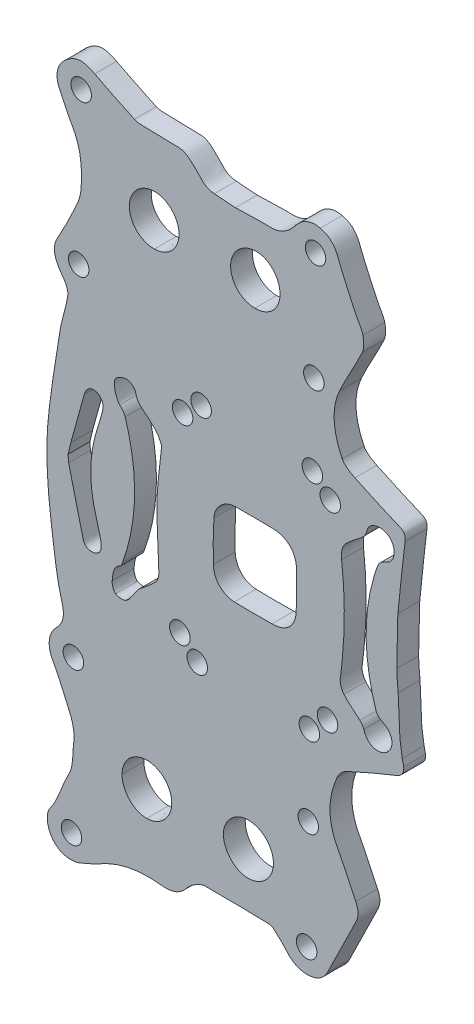
from build123d import *

# Parameters (mm, degrees)
BOSS_EXTRUDE4_DEPTH = 4
SKETCH1_R           = 1.875
CUT_EXTRUDE1_DEPTH  = 232.41140574


with BuildPart() as part:
    # Model → Boss-Extrude4 (new body)
    with BuildSketch(Plane.XY):
        with BuildLine():
            add(Edge.make_bspline(
                [(131.262063805, -129.37444485), (131.270879822, -130.612852398), (131.429599139, -131.850185075), (131.521852093, -133.088396252)],
                knots=[63, 63, 63, 63, 64, 64, 64, 64], degree=3))
            add(Edge.make_bspline(
                [(131.521852093, -133.088396252), (131.620643676, -135.363303843), (131.686639014, -137.640305557), (131.832494038, -139.91218618), (131.901837551, -140.992315682), (132.128453732, -142.061992272), (132.273283308, -143.13781669)],
                knots=[0, 0, 0, 0, 1, 1, 1, 2, 2, 2, 2], degree=3))
            add(Edge.make_bspline(
                [(132.273283308, -143.13781669), (132.375975693, -143.518434283), (132.454352202, -143.905959149), (132.534205797, -144.292313982)],
                knots=[2, 2, 2, 2, 3, 3, 3, 3], degree=3))
            add(Edge.make_bspline(
                [(132.534205797, -144.292313982), (132.629848732, -145.370658624), (132.155602813, -145.963006101), (131.121462282, -146.377038519), (128.065373871, -147.600594231), (125.025387869, -148.875588768), (122.04851959, -150.27781094)],
                knots=[3, 3, 3, 3, 4, 4, 4, 5, 5, 5, 5], degree=3))
            add(Edge.make_bspline(
                [(122.04851959, -150.27781094), (121.317058873, -150.62234875), (120.620810549, -151.43223378), (120.300757083, -152.193212135)],
                knots=[5, 5, 5, 5, 6, 6, 6, 6], degree=3))
            add(Edge.make_bspline(
                [(120.300757083, -152.193212135), (118.764031219, -155.846950036), (118.443450651, -159.512780247), (120.424201995, -163.182971958), (121.628585712, -165.414602556), (122.621674402, -167.759311752), (123.758547889, -170.028748905)],
                knots=[6, 6, 6, 6, 7, 7, 7, 8, 8, 8, 8], degree=3))
            add(Edge.make_bspline(
                [(123.758547889, -170.028748905), (124.339753906, -171.188949182), (124.311042422, -172.250271572), (123.724772105, -173.411246997), (121.971996973, -176.882215321), (120.272376328, -180.380241479), (118.573324125, -183.878060932)],
                knots=[8, 8, 8, 8, 9, 9, 9, 10, 10, 10, 10], degree=3))
            add(Edge.make_bspline(
                [(118.573324125, -183.878060932), (117.272853055, -186.555339653), (113.293532298, -186.793444467), (111.280338424, -184.355655491)],
                knots=[10, 10, 10, 10, 11, 11, 11, 11], degree=3))
            add(Edge.make_bspline(
                [(111.280338424, -184.355655491), (110.500456791, -183.411297776), (109.564853082, -182.586705603), (108.63927462, -181.77720298)],
                knots=[11, 11, 11, 11, 12, 12, 12, 12], degree=3))
            add(Edge.make_bspline(
                [(108.63927462, -181.77720298), (108.380292485, -181.550673711), (107.905777848, -181.498294372), (107.527805318, -181.491287034), (103.776626138, -181.421730414), (100.02469248, -181.337952412), (96.273730341, -181.36478287)],
                knots=[12, 12, 12, 12, 13, 13, 13, 14, 14, 14, 14], degree=3))
            add(Edge.make_bspline(
                [(96.273730341, -181.36478287), (95.588375431, -181.369702477), (94.855850178, -181.771601243), (94.237840132, -182.144106396)],
                knots=[14, 14, 14, 14, 15, 15, 15, 15], degree=3))
            add(Edge.make_bspline(
                [(94.237840132, -182.144106396), (93.669615262, -182.486597815), (93.165458963, -182.986392614), (92.739623624, -183.504480908)],
                knots=[15, 15, 15, 15, 16, 16, 16, 16], degree=3))
            add(Edge.make_bspline(
                [(92.739623624, -183.504480908), (91.512078483, -184.997932839), (89.969988595, -185.440676741), (88.089603422, -185.223097848)],
                knots=[16, 16, 16, 16, 17, 17, 17, 17], degree=3))
            add(Edge.make_bspline(
                [(88.089603422, -185.223097848), (84.089953115, -184.76032412), (80.316020755, -185.457316586), (76.815359093, -187.545090039), (75.804870912, -188.147741818), (74.657600105, -188.517229061), (73.589120515, -189.027317826)],
                knots=[17, 17, 17, 17, 18, 18, 18, 19, 19, 19, 19], degree=3))
            add(Edge.make_bspline(
                [(73.589120515, -189.027317826), (71.93733684, -189.815901787), (69.856136643, -189.49935199), (68.654336754, -188.245741204)],
                knots=[19, 19, 19, 19, 20, 20, 20, 20], degree=3))
            add(Edge.make_bspline(
                [(68.654336754, -188.245741204), (67.359663791, -186.895247246), (66.84987475, -184.513516977), (67.912313353, -183.089890383)],
                knots=[20, 20, 20, 20, 21, 21, 21, 21], degree=3))
            add(Edge.make_bspline(
                [(67.912313353, -183.089890383), (69.472024941, -180.999987857), (69.959029797, -178.454711683), (71.190001092, -176.268504762)],
                knots=[21, 21, 21, 21, 22, 22, 22, 22], degree=3))
            add(Edge.make_bspline(
                [(71.190001092, -176.268504762), (72.226038152, -174.428551312), (71.912408079, -172.533427991), (72.178464732, -170.647709799), (72.591122553, -167.722900464), (70.9986067, -165.452264416), (70.018736868, -162.980017525)],
                knots=[22, 22, 22, 22, 23, 23, 23, 24, 24, 24, 24], degree=3))
            add(Edge.make_bspline(
                [(70.018736868, -162.980017525), (69.513929445, -161.706356243), (68.837607594, -160.498685899), (68.208760977, -159.276649477), (67.341711362, -157.591715304), (67.555254318, -155.515279684), (68.882467996, -154.163669512)],
                knots=[24, 24, 24, 24, 25, 25, 25, 26, 26, 26, 26], degree=3))
            add(Edge.make_bspline(
                [(68.882467996, -154.163669512), (70.17542013, -152.846961674), (70.617135668, -151.534284606), (70.057861175, -149.60941627), (69.291301754, -146.971142999), (68.902110248, -144.20822592), (68.528618073, -141.474485415), (68.039830377, -137.896877388), (67.576570889, -134.303683718), (67.379228528, -130.702025431), (67.210514969, -127.62289962), (67.204949406, -124.497988396), (67.533100586, -121.43684602), (68.066598823, -116.460157755), (68.874592491, -111.50967983), (69.683526673, -106.567263444)],
                knots=[26, 26, 26, 26, 27, 27, 27, 28, 28, 28, 29, 29, 29, 30, 30, 30, 31, 31, 31, 31], degree=3))
            add(Edge.make_bspline(
                [(69.683526673, -106.567263444), (70.023780498, -104.488430032), (70.789435579, -102.477241208), (71.097975514, -100.396206376), (71.213074666, -99.619869754), (70.7621452, -98.589801334), (70.249069531, -97.921158616)],
                knots=[31, 31, 31, 31, 32, 32, 32, 33, 33, 33, 33], degree=3))
            add(Edge.make_bspline(
                [(70.249069531, -97.921158616), (68.529894484, -95.680701666), (68.180018487, -93.996056882), (69.252528848, -92.12058098)],
                knots=[33, 33, 33, 33, 34, 34, 34, 34], degree=3))
            add(Edge.make_bspline(
                [(69.252528848, -92.12058098), (69.824133364, -91.121012052), (70.365734482, -90.10215744), (70.873663168, -89.068812727)],
                knots=[34, 34, 34, 34, 35, 35, 35, 35], degree=3))
            add(Edge.make_bspline(
                [(70.873663168, -89.068812727), (71.606457139, -87.577965294), (72.343974346, -86.085908629), (72.983404317, -84.554257401), (73.279908785, -83.844030574), (73.44502049, -83.046749452), (73.505978134, -82.275978393), (73.767166857, -78.973429072), (73.551112421, -75.762926), (71.770860875, -72.805116028)],
                knots=[35, 35, 35, 35, 36, 36, 36, 37, 37, 37, 38, 38, 38, 38], degree=3))
            add(Edge.make_bspline(
                [(71.770860875, -72.805116028), (70.951865272, -71.444400451), (70.379914523, -69.937331752), (69.644758934, -68.523234311), (68.661023698, -66.630984205), (69.088140615, -64.542668149), (70.791383785, -63.184686261)],
                knots=[38, 38, 38, 38, 39, 39, 39, 40, 40, 40, 40], degree=3))
            add(Edge.make_bspline(
                [(70.791383785, -63.184686261), (72.623942322, -61.723620015), (73.884953188, -61.695099734), (76.012967161, -62.811907223)],
                knots=[40, 40, 40, 40, 41, 41, 41, 41], degree=3))
            add(Edge.make_bspline(
                [(76.012967161, -62.811907223), (78.399575694, -64.064412131), (80.842956072, -65.210385857), (83.281142957, -66.361377374)],
                knots=[41, 41, 41, 41, 42, 42, 42, 42], degree=3))
            add(Edge.make_bspline(
                [(83.281142957, -66.361377374), (83.696090049, -66.557267625), (84.20728986, -66.605895247), (84.677003747, -66.619512014), (86.960946504, -66.685719994), (89.247964014, -66.675756758), (91.529049058, -66.789698355), (92.091155426, -66.817774218), (92.724802793, -67.097948901), (93.168425196, -67.456599573), (94.042523491, -68.163276222), (94.838962286, -68.975972456), (95.606141825, -69.801825535), (96.247137595, -70.491841669), (96.999506638, -70.786062035), (97.918563521, -70.836214114)],
                knots=[42, 42, 42, 42, 43, 43, 43, 44, 44, 44, 45, 45, 45, 46, 46, 46, 47, 47, 47, 47], degree=3))
            add(Edge.make_bspline(
                [(97.918563521, -70.836214114), (99.199087447, -70.906101463), (100.475446245, -71.120967338), (101.754657588, -71.13061018)],
                knots=[47, 47, 47, 47, 48, 48, 48, 48], degree=3))
            add(Edge.make_bspline(
                [(101.754657588, -71.13061018), (103.821698414, -71.146211327), (105.895012771, -70.929226714), (107.955687048, -71.025143535), (110.148229512, -71.127199529), (111.549356142, -69.994899414), (112.778430908, -68.440479504)],
                knots=[48, 48, 48, 48, 49, 49, 49, 50, 50, 50, 50], degree=3))
            add(Edge.make_bspline(
                [(112.778430908, -68.440479504), (113.936305741, -66.976121464), (115.375414625, -66.189475373), (117.274310334, -66.609218048)],
                knots=[50, 50, 50, 50, 51, 51, 51, 51], degree=3))
            add(Edge.make_bspline(
                [(117.274310334, -66.609218048), (119.139450928, -67.021493463), (120.073886748, -68.276075768), (120.713435575, -70.059128183), (121.576061679, -72.464123228), (122.755196239, -74.756752811), (123.822833502, -77.086455141), (124.221642012, -77.956693199), (124.873479519, -78.754940672), (125.072754583, -79.660236093)],
                knots=[51, 51, 51, 51, 52, 52, 52, 53, 53, 53, 54, 54, 54, 54], degree=3))
            add(Edge.make_bspline(
                [(125.072754583, -79.660236093), (125.270438009, -80.558260625), (125.322372929, -81.678773321), (124.952668645, -82.476762412)],
                knots=[54, 54, 54, 54, 55, 55, 55, 55], degree=3))
            add(Edge.make_bspline(
                [(124.952668645, -82.476762412), (123.675762077, -85.232951205), (122.069634623, -87.837402182), (120.808282692, -90.599812831)],
                knots=[55, 55, 55, 55, 56, 56, 56, 56], degree=3))
            add(Edge.make_bspline(
                [(120.808282692, -90.599812831), (119.191241154, -94.141174934), (119.626936376, -97.736673378), (121.286631728, -101.137940388)],
                knots=[56, 56, 56, 56, 57, 57, 57, 57], degree=3))
            add(Edge.make_bspline(
                [(121.286631728, -101.137940388), (121.682339646, -101.948848613), (122.722360967, -102.570331322), (123.602774135, -102.996239009)],
                knots=[57, 57, 57, 57, 58, 58, 58, 58], degree=3))
            add(Edge.make_bspline(
                [(123.602774135, -102.996239009), (126.210909649, -104.257911334), (128.870225606, -105.419641237), (131.546377778, -106.531761663), (132.488037978, -106.92308741), (132.934223538, -107.340406456), (132.795099964, -108.45801493)],
                knots=[58, 58, 58, 58, 59, 59, 59, 60, 60, 60, 60], degree=3))
            add(Edge.make_bspline(
                [(132.795099964, -108.45801493), (132.29416828, -112.481963546), (131.869593849, -116.51613378), (131.474371691, -120.5521437)],
                knots=[60, 60, 60, 60, 61, 61, 61, 61], degree=3))
            add(Edge.make_bspline(
                [(131.474371691, -120.5521437), (131.354265083, -121.778593297), (131.432286319, -123.02370846), (131.401301067, -124.259811235), (131.358554235, -125.964950935), (131.249919818, -127.670007951), (131.262063805, -129.37444485)],
                knots=[61, 61, 61, 61, 62, 62, 62, 63, 63, 63, 63], degree=3))
        make_face()
        with BuildLine():
            add(Edge.make_bspline(
                [(108.459107982, -133.699501026), (111.148346631, -133.721424515), (112.832333857, -132.028921605), (112.894414732, -129.344445521), (112.917864091, -128.330477279), (112.931197315, -127.316299046), (112.949139182, -126.302212688)],
                knots=[8, 8, 8, 8, 9, 9, 9, 10, 10, 10, 10], degree=3))
            add(Edge.make_bspline(
                [(112.949139182, -126.302212688), (112.949139182, -125.202442954), (112.955019972, -124.102631879), (112.947971292, -123.002913822)],
                knots=[1, 1, 1, 1, 2, 2, 2, 2], degree=3))
            add(Edge.make_bspline(
                [(112.947971292, -123.002913822), (112.930721664, -120.307765354), (111.297484699, -118.601540448), (108.595029169, -118.533709825)],
                knots=[2, 2, 2, 2, 3, 3, 3, 3], degree=3))
            add(Edge.make_bspline(
                [(108.595029169, -118.533709825), (106.339885746, -118.47709301), (104.082509898, -118.46700575), (101.826715351, -118.491510764)],
                knots=[3, 3, 3, 3, 4, 4, 4, 4], degree=3))
            add(Edge.make_bspline(
                [(101.826715351, -118.491510764), (99.759126754, -118.513959052), (97.922470267, -120.178698034), (97.818507409, -122.237687656)],
                knots=[4, 4, 4, 4, 5, 5, 5, 5], degree=3))
            add(Edge.make_bspline(
                [(97.818507409, -122.237687656), (97.693460524, -124.713934311), (97.653783279, -127.199534419), (97.707268495, -129.678271884)],
                knots=[5, 5, 5, 5, 6, 6, 6, 6], degree=3))
            add(Edge.make_bspline(
                [(97.707268495, -129.678271884), (97.755524045, -131.914801417), (99.422733166, -133.613894961), (101.52330173, -133.682335367)],
                knots=[6, 6, 6, 6, 7, 7, 7, 7], degree=3))
            add(Edge.make_bspline(
                [(101.52330173, -133.682335367), (103.834474358, -133.731435625), (106.148159182, -133.747732066), (108.459107982, -133.699501026)],
                knots=[7, 7, 7, 7, 8, 8, 8, 8], degree=3))
        make_face(mode=Mode.SUBTRACT)
        with BuildLine():
            add(Edge.make_bspline(
                [(130.689467099, -110.482629319), (130.411705711, -109.389443176), (129.418668697, -108.623968963), (128.261920413, -108.610160992)],
                knots=[15, 15, 15, 15, 16, 16, 16, 16], degree=3))
            add(Edge.make_bspline(
                [(128.261920413, -108.610160992), (127.091663882, -108.607205094), (126.08708233, -109.144568736), (125.838693885, -110.219182331), (125.57248737, -111.37087665), (124.816242587, -111.878557289), (124.009706197, -112.474470448)],
                knots=[0, 0, 0, 0, 1, 1, 1, 2, 2, 2, 2], degree=3))
            add(Edge.make_bspline(
                [(124.009706197, -112.474470448), (123.46680283, -112.875604402), (122.979327717, -113.350873517), (122.4475038, -113.768058203)],
                knots=[2, 2, 2, 2, 3, 3, 3, 3], degree=3))
            add(Edge.make_bspline(
                [(122.4475038, -113.768058203), (121.314857453, -114.656543246), (121.00853961, -115.774606474), (121.180219402, -117.20131299)],
                knots=[3, 3, 3, 3, 4, 4, 4, 4], degree=3))
            add(Edge.make_bspline(
                [(121.180219402, -117.20131299), (121.941900558, -123.531368429), (121.770437807, -129.853289981), (120.932554429, -136.172079934), (120.842637254, -136.850189793), (121.144645274, -137.767985769), (121.59491328, -138.28971209)],
                knots=[4, 4, 4, 4, 5, 5, 5, 6, 6, 6, 6], degree=3))
            add(Edge.make_bspline(
                [(121.59491328, -138.28971209), (122.450501039, -139.281054113), (123.562817836, -140.047086433), (124.52982021, -140.948221893)],
                knots=[6, 6, 6, 6, 7, 7, 7, 7], degree=3))
            add(Edge.make_bspline(
                [(124.52982021, -140.948221893), (124.833667915, -141.231378312), (125.121909305, -141.617329699), (125.230626405, -142.008159352)],
                knots=[7, 7, 7, 7, 8, 8, 8, 8], degree=3))
            add(Edge.make_bspline(
                [(125.230626405, -142.008159352), (125.601353884, -143.34099027), (126.635494416, -144.213186868), (127.904267098, -144.152353248), (129.16416175, -144.091943376), (130.199263465, -143.139575797), (130.37032314, -141.88341219)],
                knots=[8, 8, 8, 8, 9, 9, 9, 10, 10, 10, 10], degree=3))
            add(Edge.make_bspline(
                [(130.37032314, -141.88341219), (130.532825179, -140.690118259), (129.740086425, -139.585036177), (128.518442745, -139.066007371)],
                knots=[10, 10, 10, 10, 11, 11, 11, 11], degree=3))
            add(Edge.make_bspline(
                [(128.518442745, -139.066007371), (128.100234863, -138.888312429), (127.635983186, -138.450291763), (127.500115234, -138.031494768)],
                knots=[11, 11, 11, 11, 12, 12, 12, 12], degree=3))
            add(Edge.make_bspline(
                [(127.500115234, -138.031494768), (125.068641131, -130.53626777), (125.017295323, -123.032886213), (127.517147821, -115.532460555), (127.829656513, -114.59482079), (128.191712669, -113.863432421), (129.26768019, -113.484374683)],
                knots=[12, 12, 12, 12, 13, 13, 13, 14, 14, 14, 14], degree=3))
            add(Edge.make_bspline(
                [(129.26768019, -113.484374683), (130.518676143, -113.043666837), (131.009541237, -111.742368942), (130.689467099, -110.482629319)],
                knots=[14, 14, 14, 14, 15, 15, 15, 15], degree=3))
        make_face(mode=Mode.SUBTRACT)
        with BuildLine():
            add(Edge.make_bspline(
                [(87.386265077, -124.857109325), (87.499919353, -121.761081556), (87.961853106, -118.677822182), (88.269520455, -115.588912005)],
                knots=[18, 18, 18, 18, 19, 19, 19, 19], degree=3))
            add(Edge.make_bspline(
                [(88.269520455, -115.588912005), (88.003830705, -115.058545366), (87.828109808, -114.45046755), (87.452173333, -114.015361441), (86.829388375, -113.294556426), (86.120277761, -112.63066795), (85.368900907, -112.043395108)],
                knots=[1, 1, 1, 1, 2, 2, 2, 3, 3, 3, 3], degree=3))
            add(Edge.make_bspline(
                [(85.368900907, -112.043395108), (84.545228577, -111.399588134), (83.782973812, -110.824417938), (83.543954323, -109.671566064)],
                knots=[3, 3, 3, 3, 4, 4, 4, 4], degree=3))
            add(Edge.make_bspline(
                [(83.543954323, -109.671566064), (83.364021788, -108.803730966), (82.574631673, -108.18371587), (81.658112108, -108.261065311)],
                knots=[4, 4, 4, 4, 5, 5, 5, 5], degree=3))
            add(Edge.make_bspline(
                [(81.658112108, -108.261065311), (81.03030419, -108.314064768), (80.273397947, -108.650168967), (79.869008371, -109.115764234)],
                knots=[5, 5, 5, 5, 6, 6, 6, 6], degree=3))
            add(Edge.make_bspline(
                [(79.869008371, -109.115764234), (79.25136006, -109.826936742), (79.878372159, -112.270575502), (80.598489876, -112.950018616)],
                knots=[6, 6, 6, 6, 7, 7, 7, 7], degree=3))
            add(Edge.make_bspline(
                [(80.598489876, -112.950018616), (81.005897362, -113.334419707), (81.42591909, -113.817553991), (81.586245547, -114.334929148)],
                knots=[7, 7, 7, 7, 8, 8, 8, 8], degree=3))
            add(Edge.make_bspline(
                [(81.586245547, -114.334929148), (84.000283987, -122.125311857), (83.904589375, -129.880120439), (81.140860974, -137.575966091)],
                knots=[8, 8, 8, 8, 9, 9, 9, 9], degree=3))
            add(Edge.make_bspline(
                [(81.140860974, -137.575966091), (81.037451055, -137.863897422), (80.929907013, -138.262437214), (80.7057652, -138.376487332), (79.393765095, -139.044065513), (79.324725241, -140.325261234), (79.213517332, -141.49803958)],
                knots=[9, 9, 9, 9, 10, 10, 10, 11, 11, 11, 11], degree=3))
            add(Edge.make_bspline(
                [(79.213517332, -141.49803958), (79.158647185, -142.076785793), (79.410585808, -142.948124561), (79.832328365, -143.23797826)],
                knots=[11, 11, 11, 11, 12, 12, 12, 12], degree=3))
            add(Edge.make_bspline(
                [(79.832328365, -143.23797826), (80.298373217, -143.558259103), (81.270486401, -143.61881367), (81.745993228, -143.333001077)],
                knots=[12, 12, 12, 12, 13, 13, 13, 13], degree=3))
            add(Edge.make_bspline(
                [(81.745993228, -143.333001077), (82.400564424, -142.939546256), (82.803264177, -142.12053515), (83.299488128, -141.472831765), (83.558253221, -141.135073917), (83.729891673, -140.710840551), (84.038405769, -140.434577782)],
                knots=[13, 13, 13, 13, 14, 14, 14, 15, 15, 15, 15], degree=3))
            add(Edge.make_bspline(
                [(84.038405769, -140.434577782), (85.064427916, -139.515758611), (86.207161523, -138.715609441), (87.153627641, -137.725156254)],
                knots=[15, 15, 15, 15, 16, 16, 16, 16], degree=3))
            add(Edge.make_bspline(
                [(87.153627641, -137.725156254), (87.554813272, -137.3053464), (87.759576384, -136.521661374), (87.745747742, -135.910327937), (87.662372817, -132.224715947), (87.362783259, -128.540323524), (87.386265077, -124.857109325)],
                knots=[16, 16, 16, 16, 17, 17, 17, 18, 18, 18, 18], degree=3))
        make_face(mode=Mode.SUBTRACT)
        with BuildLine():
            add(Edge.make_bspline(
                [(71.64413967, -123.402177085), (71.429837069, -124.184931933), (71.271355464, -124.982962365), (71.154426963, -125.485330656)],
                knots=[11, 11, 11, 11, 12, 12, 12, 12], degree=3))
            add(Edge.make_bspline(
                [(71.154426963, -125.485330656), (71.198951468, -126.136661733), (71.173624797, -126.485674731), (71.252472858, -126.80931455)],
                knots=[0, 0, 0, 0, 1, 1, 1, 1], degree=3))
            add(Edge.make_bspline(
                [(71.252472858, -126.80931455), (72.126002711, -130.394632716), (72.998731578, -133.980353959), (73.913127237, -137.555367823), (74.136571417, -138.428959688), (74.806009953, -138.854939721), (75.712736814, -138.739556348), (76.603536966, -138.626198696), (77.143716979, -138.083729412), (77.209356517, -137.175638291)],
                knots=[1, 1, 1, 1, 2, 2, 2, 3, 3, 3, 4, 4, 4, 4], degree=3))
            add(Edge.make_bspline(
                [(77.209356517, -137.175638291), (77.239220388, -136.762432698), (77.181668228, -136.329279961), (77.086226831, -135.923402101)],
                knots=[4, 4, 4, 4, 5, 5, 5, 5], degree=3))
            add(Edge.make_bspline(
                [(77.086226831, -135.923402101), (76.860617404, -134.964037519), (76.614414877, -134.007814871), (76.330938063, -133.064015262)],
                knots=[5, 5, 5, 5, 6, 6, 6, 6], degree=3))
            add(Edge.make_bspline(
                [(76.330938063, -133.064015262), (74.894583538, -128.282023519), (74.940033053, -123.523885666), (76.492406572, -118.774656848), (76.859769909, -117.650774842), (77.196783615, -116.513467271), (77.473382282, -115.364429126), (77.746022526, -114.23182412), (77.186195093, -113.231800439), (76.245413394, -113.000093181), (75.25420573, -112.755962882), (74.437830127, -113.335701285), (74.106733384, -114.525036794)],
                knots=[6, 6, 6, 6, 7, 7, 7, 8, 8, 8, 9, 9, 9, 10, 10, 10, 10], degree=3))
            add(Edge.make_bspline(
                [(74.106733384, -114.525036794), (73.283164407, -117.483332525), (72.455047895, -120.44040869), (71.64413967, -123.402177085)],
                knots=[10, 10, 10, 10, 11, 11, 11, 11], degree=3))
        make_face(mode=Mode.SUBTRACT)
        with BuildLine():
            add(Edge.make_bspline(
                [(104.082840628, -166.939101751), (101.724116754, -166.934636898), (99.552513622, -169.072950004), (99.544111017, -171.408223065), (99.535129635, -173.903807081), (101.615802732, -176.14909062), (103.972965974, -176.187496622), (106.540535406, -176.229333947), (108.683106659, -174.137488383), (108.707880391, -171.564709956)],
                knots=[1, 1, 1, 1, 2, 2, 2, 3, 3, 3, 4, 4, 4, 4], degree=3))
            add(Edge.make_bspline(
                [(108.707880391, -171.564709956), (108.732251046, -169.033758518), (106.642689585, -166.943928339), (104.082840628, -166.939101751)],
                knots=[0, 0, 0, 0, 1, 1, 1, 1], degree=3))
        make_face(mode=Mode.SUBTRACT)
        with BuildLine():
            add(Edge.make_bspline(
                [(85.524845194, -175.980232366), (87.963936418, -175.966155677), (90.084834532, -173.820876573), (90.110528106, -171.341839385)],
                knots=[3, 3, 3, 3, 4, 4, 4, 4], degree=3))
            add(Edge.make_bspline(
                [(90.110528106, -171.341839385), (90.136769452, -168.810422859), (88.117922165, -166.763504877), (85.577968674, -166.746244913)],
                knots=[0, 0, 0, 0, 1, 1, 1, 1], degree=3))
            add(Edge.make_bspline(
                [(85.577968674, -166.746244913), (83.061093925, -166.729129644), (81.050220328, -168.697788678), (81.01812403, -171.210374274)],
                knots=[1, 1, 1, 1, 2, 2, 2, 2], degree=3))
            add(Edge.make_bspline(
                [(81.01812403, -171.210374274), (80.9855058, -173.762874828), (83.093794838, -175.994247043), (85.524845194, -175.980232366)],
                knots=[2, 2, 2, 2, 3, 3, 3, 3], degree=3))
        make_face(mode=Mode.SUBTRACT)
        with BuildLine():
            add(Edge.make_bspline(
                [(86.938353522, -75.957607019), (84.39139786, -75.99183239), (82.331896641, -78.096927818), (82.354603312, -80.642829278), (82.376891402, -83.141643077), (84.402875219, -85.108364241), (86.938260504, -85.092416862)],
                knots=[2, 2, 2, 2, 3, 3, 3, 4, 4, 4, 4], degree=3))
            add(Edge.make_bspline(
                [(86.938260504, -85.092416862), (89.40294195, -85.0769139), (91.428310816, -83.020781992), (91.44002072, -80.522288587)],
                knots=[0, 0, 0, 0, 1, 1, 1, 1], degree=3))
            add(Edge.make_bspline(
                [(91.44002072, -80.522288587), (91.45164794, -78.042750136), (89.363161351, -75.92503013), (86.938353522, -75.957607019)],
                knots=[1, 1, 1, 1, 2, 2, 2, 2], degree=3))
        make_face(mode=Mode.SUBTRACT)
        with BuildLine():
            add(Edge.make_bspline(
                [(109.916305213, -80.797057904), (109.939404625, -78.291629508), (107.967427957, -76.154138059), (105.621499194, -76.141766696), (103.048896467, -76.128201605), (100.90214975, -78.228940701), (100.877655071, -80.78396307), (100.85393554, -83.258390711), (102.810285223, -85.241224619), (105.304577325, -85.270830107)],
                knots=[1, 1, 1, 1, 2, 2, 2, 3, 3, 3, 4, 4, 4, 4], degree=3))
            add(Edge.make_bspline(
                [(105.304577325, -85.270830107), (107.888331849, -85.301500132), (109.892709706, -83.357087729), (109.916305213, -80.797057904)],
                knots=[0, 0, 0, 0, 1, 1, 1, 1], degree=3))
        make_face(mode=Mode.SUBTRACT)
        with BuildLine():
            add(Edge.make_bspline(
                [(69.921946714, -185.044297028), (69.875840907, -186.02852836), (70.683710552, -186.839622621), (71.737198779, -186.866804479)],
                knots=[3, 3, 3, 3, 4, 4, 4, 4], degree=3))
            add(Edge.make_bspline(
                [(71.737198779, -186.866804479), (72.651982012, -186.890410322), (73.443873271, -186.114745495), (73.478083139, -185.161582098), (73.510918411, -184.246742021), (72.728732005, -183.412910084), (71.805525496, -183.378596863)],
                knots=[0, 0, 0, 0, 1, 1, 1, 2, 2, 2, 2], degree=3))
            add(Edge.make_bspline(
                [(71.805525496, -183.378596863), (70.818736176, -183.341906521), (69.9663782, -184.095660496), (69.921946714, -185.044297028)],
                knots=[2, 2, 2, 2, 3, 3, 3, 3], degree=3))
        make_face(mode=Mode.SUBTRACT)
        with BuildLine():
            add(Edge.make_bspline(
                [(114.856303136, -183.478353251), (115.765903212, -183.475666071), (116.516949337, -182.685180413), (116.536038649, -181.710416223)],
                knots=[3, 3, 3, 3, 4, 4, 4, 4], degree=3))
            add(Edge.make_bspline(
                [(116.536038649, -181.710416223), (116.554993603, -180.742080594), (115.839407919, -179.988367961), (114.871547715, -179.957258685)],
                knots=[0, 0, 0, 0, 1, 1, 1, 1], degree=3))
            add(Edge.make_bspline(
                [(114.871547715, -179.957258685), (113.871100286, -179.925115879), (113.046983538, -180.680254785), (113.032338407, -181.642575265)],
                knots=[1, 1, 1, 1, 2, 2, 2, 2], degree=3))
            add(Edge.make_bspline(
                [(113.032338407, -181.642575265), (113.017321205, -182.628687622), (113.864434012, -183.481288478), (114.856303136, -183.478353251)],
                knots=[2, 2, 2, 2, 3, 3, 3, 3], degree=3))
        make_face(mode=Mode.SUBTRACT)
        with BuildLine():
            add(Edge.make_bspline(
                [(116.835266472, -161.686595135), (116.813924062, -160.750123259), (116.026962744, -159.985992636), (115.095317457, -159.997134097), (114.069724225, -160.009402107), (113.320796839, -160.749689176), (113.332082994, -161.74003901)],
                knots=[2, 2, 2, 2, 3, 3, 3, 4, 4, 4, 4], degree=3))
            add(Edge.make_bspline(
                [(113.332082994, -161.74003901), (113.343296803, -162.724756101), (114.114124706, -163.478375717), (115.112308702, -163.480546131), (116.076117466, -163.482644198), (116.857632077, -162.66892477), (116.835266472, -161.686595135)],
                knots=[0, 0, 0, 0, 1, 1, 1, 2, 2, 2, 2], degree=3))
        make_face(mode=Mode.SUBTRACT)
        with BuildLine():
            add(Edge.make_bspline(
                [(70.325711003, -157.143483354), (70.307484689, -158.132623956), (71.062075823, -158.875164123), (72.095399865, -158.884920653)],
                knots=[3, 3, 3, 3, 4, 4, 4, 4], degree=3))
            add(Edge.make_bspline(
                [(72.095399865, -158.884920653), (73.064469301, -158.8940674), (73.794446901, -158.176073589), (73.824129904, -157.184566201)],
                knots=[0, 0, 0, 0, 1, 1, 1, 1], degree=3))
            add(Edge.make_bspline(
                [(73.824129904, -157.184566201), (73.852495155, -156.23682884), (73.098849701, -155.453061133), (72.143329854, -155.436627994)],
                knots=[1, 1, 1, 1, 2, 2, 2, 2], degree=3))
            add(Edge.make_bspline(
                [(72.143329854, -155.436627994), (71.12029461, -155.41901663), (70.344045839, -156.147976202), (70.325711003, -157.143483354)],
                knots=[2, 2, 2, 2, 3, 3, 3, 3], degree=3))
        make_face(mode=Mode.SUBTRACT)
        with BuildLine():
            add(Edge.make_bspline(
                [(118.166505752, -70.90505243), (118.174929028, -70.00508486), (117.462816007, -69.310159455), (116.53808504, -69.315962731)],
                knots=[3, 3, 3, 3, 4, 4, 4, 4], degree=3))
            add(Edge.make_bspline(
                [(116.53808504, -69.315962731), (115.46346111, -69.322706519), (114.628523295, -70.038700448), (114.626208186, -70.955478395), (114.623924083, -71.859450896), (115.474240835, -72.660798962), (116.405462375, -72.632268346)],
                knots=[0, 0, 0, 0, 1, 1, 1, 2, 2, 2, 2], degree=3))
            add(Edge.make_bspline(
                [(116.405462375, -72.632268346), (117.342637051, -72.603546526), (118.158103147, -71.803753924), (118.166505752, -70.90505243)],
                knots=[2, 2, 2, 2, 3, 3, 3, 3], degree=3))
        make_face(mode=Mode.SUBTRACT)
        with BuildLine():
            add(Edge.make_bspline(
                [(73.223121438, -92.787900778), (72.092304441, -92.78963711), (71.324044862, -93.439118167), (71.332416461, -94.386287086)],
                knots=[3, 3, 3, 3, 4, 4, 4, 4], degree=3))
            add(Edge.make_bspline(
                [(71.332416461, -94.386287086), (71.340751887, -95.329321882), (72.095425704, -96.049982202), (73.082736957, -96.057702677)],
                knots=[0, 0, 0, 0, 1, 1, 1, 1], degree=3))
            add(Edge.make_bspline(
                [(73.082736957, -96.057702677), (74.064177755, -96.06538181), (74.857231737, -95.261646289), (74.830142896, -94.286799416)],
                knots=[1, 1, 1, 1, 2, 2, 2, 2], degree=3))
            add(Edge.make_bspline(
                [(74.830142896, -94.286799416), (74.806903957, -93.450848741), (74.094697918, -92.786557188), (73.223121438, -92.787900778)],
                knots=[2, 2, 2, 2, 3, 3, 3, 3], degree=3))
        make_face(mode=Mode.SUBTRACT)
        with BuildLine():
            add(Edge.make_bspline(
                [(93.071180288, -146.572334489), (93.038882452, -147.562653317), (93.808087711, -148.350978895), (94.806271708, -148.350555148), (95.706911073, -148.350172741), (96.463031833, -147.598847564), (96.483816136, -146.683635416)],
                knots=[2, 2, 2, 2, 3, 3, 3, 4, 4, 4, 4], degree=3))
            add(Edge.make_bspline(
                [(96.483816136, -146.683635416), (96.504807146, -145.759441885), (95.78411582, -144.98718771), (94.876045369, -144.960812005)],
                knots=[0, 0, 0, 0, 1, 1, 1, 1], degree=3))
            add(Edge.make_bspline(
                [(94.876045369, -144.960812005), (93.881116994, -144.931924821), (93.10201051, -145.627573697), (93.071180288, -146.572334489)],
                knots=[1, 1, 1, 1, 2, 2, 2, 2], degree=3))
        make_face(mode=Mode.SUBTRACT)
        with BuildLine():
            add(Edge.make_bspline(
                [(117.002316047, -146.954389466), (117.017808673, -146.013473408), (116.308382832, -145.268917857), (115.380654626, -145.252422706), (114.32853066, -145.233715799), (113.531554429, -145.968091073), (113.553361928, -146.936178654), (113.57461132, -147.879420156), (114.349532004, -148.609247894), (115.326569962, -148.606209314)],
                knots=[1, 1, 1, 1, 2, 2, 2, 3, 3, 3, 4, 4, 4, 4], degree=3))
            add(Edge.make_bspline(
                [(115.326569962, -148.606209314), (116.268075132, -148.603284422), (116.986823421, -147.894799094), (117.002316047, -146.954389466)],
                knots=[0, 0, 0, 0, 1, 1, 1, 1], degree=3))
        make_face(mode=Mode.SUBTRACT)
        with BuildLine():
            add(Edge.make_bspline(
                [(114.374708813, -90.956835692), (114.391017929, -91.888491315), (115.091493393, -92.529259708), (116.095620192, -92.531058052)],
                knots=[3, 3, 3, 3, 4, 4, 4, 4], degree=3))
            add(Edge.make_bspline(
                [(116.095620192, -92.531058052), (117.073474639, -92.532804719), (117.841977097, -91.795659583), (117.845088025, -90.852965852), (117.84796124, -89.981337696), (117.222168707, -89.320188076), (116.390837915, -89.316581054), (115.092588936, -89.310948311), (114.356394648, -89.909889715), (114.374708813, -90.956835692)],
                knots=[0, 0, 0, 0, 1, 1, 1, 2, 2, 2, 3, 3, 3, 3], degree=3))
        make_face(mode=Mode.SUBTRACT)
        with BuildLine():
            add(Edge.make_bspline(
                [(71.720150689, -66.455909264), (71.712910806, -67.420296806), (72.506037135, -68.157395432), (73.539511039, -68.146744898)],
                knots=[3, 3, 3, 3, 4, 4, 4, 4], degree=3))
            add(Edge.make_bspline(
                [(73.539511039, -68.146744898), (74.504751243, -68.136797165), (75.218740122, -67.394778931), (75.210539056, -66.410118685), (75.20321649, -65.530966424), (74.626103256, -64.896507736), (73.848779612, -64.913033893), (72.504631533, -64.941611018), (71.727292386, -65.505045473), (71.720150689, -66.455909264)],
                knots=[0, 0, 0, 0, 1, 1, 1, 2, 2, 2, 3, 3, 3, 3], degree=3))
        make_face(mode=Mode.SUBTRACT)
        with BuildLine():
            add(Edge.make_bspline(
                [(89.859121752, -143.540306674), (89.87084199, -144.485098473), (90.638620977, -145.182421668), (91.651594799, -145.168272632), (92.579271328, -145.155312157), (93.301771333, -144.412802997), (93.293544428, -143.480837315), (93.285255512, -142.541626583), (92.569618151, -141.864974002), (91.596879681, -141.876621893)],
                knots=[1, 1, 1, 1, 2, 2, 2, 3, 3, 3, 4, 4, 4, 4], degree=3))
            add(Edge.make_bspline(
                [(91.596879681, -141.876621893), (90.557282107, -141.889065604), (89.847081118, -142.569004812), (89.859121752, -143.540306674)],
                knots=[0, 0, 0, 0, 1, 1, 1, 1], degree=3))
        make_face(mode=Mode.SUBTRACT)
        with BuildLine():
            add(Edge.make_bspline(
                [(119.154230418, -107.135726026), (118.124368703, -107.158660074), (117.390530866, -107.84556528), (117.38091903, -108.795648755), (117.371813624, -109.695843702), (118.145225354, -110.419160196), (119.100662519, -110.403987964)],
                knots=[2, 2, 2, 2, 3, 3, 3, 4, 4, 4, 4], degree=3))
            add(Edge.make_bspline(
                [(119.100662519, -110.403987964), (120.040441693, -110.38906378), (120.764791718, -109.659174031), (120.762083867, -108.729854188)],
                knots=[0, 0, 0, 0, 1, 1, 1, 1], degree=3))
            add(Edge.make_bspline(
                [(120.762083867, -108.729854188), (120.759386352, -107.802415371), (120.066455662, -107.115417147), (119.154230418, -107.135726026)],
                knots=[1, 1, 1, 1, 2, 2, 2, 2], degree=3))
        make_face(mode=Mode.SUBTRACT)
        with BuildLine():
            add(Edge.make_bspline(
                [(116.917328813, -143.847316983), (116.917680214, -144.817295926), (117.649905743, -145.522473955), (118.654228912, -145.520065829), (119.629726909, -145.517730049), (120.276748163, -144.858750844), (120.281802129, -143.862396197)],
                knots=[2, 2, 2, 2, 3, 3, 3, 4, 4, 4, 4], degree=3))
            add(Edge.make_bspline(
                [(120.281802129, -143.862396197), (120.286928441, -142.852543638), (119.659988689, -142.207920175), (118.668274595, -142.203351969), (117.629948264, -142.198566722), (116.916977413, -142.867974252), (116.917328813, -143.847316983)],
                knots=[0, 0, 0, 0, 1, 1, 1, 2, 2, 2, 2], degree=3))
        make_face(mode=Mode.SUBTRACT)
        with BuildLine():
            add(Edge.make_bspline(
                [(115.824101329, -107.401302087), (116.744119395, -107.423554004), (117.495609937, -106.695576287), (117.517469113, -105.760902754), (117.539276612, -104.828399637), (116.939859783, -104.199361817), (116.017733315, -104.187083472)],
                knots=[2, 2, 2, 2, 3, 3, 3, 4, 4, 4, 4], degree=3))
            add(Edge.make_bspline(
                [(116.017733315, -104.187083472), (114.901406418, -104.172210965), (114.130268456, -104.769767437), (114.102611173, -105.671109603)],
                knots=[0, 0, 0, 0, 1, 1, 1, 1], degree=3))
            add(Edge.make_bspline(
                [(114.102611173, -105.671109603), (114.074302766, -106.593298084), (114.854938876, -107.377882281), (115.824101329, -107.401302087)],
                knots=[1, 1, 1, 1, 2, 2, 2, 2], degree=3))
        make_face(mode=Mode.SUBTRACT)
        with BuildLine():
            add(Edge.make_bspline(
                [(93.806899151, -108.429189758), (93.819363532, -107.529852642), (93.249505683, -106.914777823), (92.377267743, -106.886118015)],
                knots=[3, 3, 3, 3, 4, 4, 4, 4], degree=3))
            add(Edge.make_bspline(
                [(92.377267743, -106.886118015), (91.233076858, -106.848518167), (90.416825279, -107.455510775), (90.381550874, -108.370185487), (90.347434024, -109.254898143), (91.090873362, -110.018222613), (92.029329617, -110.062033981), (93.000776173, -110.10738531), (93.793742304, -109.37897351), (93.806899151, -108.429189758)],
                knots=[0, 0, 0, 0, 1, 1, 1, 2, 2, 2, 3, 3, 3, 3], degree=3))
        make_face(mode=Mode.SUBTRACT)
        with BuildLine():
            add(Edge.make_bspline(
                [(95.482345512, -107.163093921), (96.342015717, -107.140397585), (97.036589722, -106.391645899), (97.044134496, -105.479503337), (97.051730947, -104.560911544), (96.470803984, -103.949764142), (95.599692593, -103.959923749)],
                knots=[2, 2, 2, 2, 3, 3, 3, 4, 4, 4, 4], degree=3))
            add(Edge.make_bspline(
                [(95.599692593, -103.959923749), (94.470611927, -103.973090931), (93.667982283, -104.585819635), (93.660912933, -105.439981122), (93.652934075, -106.404058604), (94.48315899, -107.189469625), (95.482345512, -107.163093921)],
                knots=[0, 0, 0, 0, 1, 1, 1, 2, 2, 2, 2], degree=3))
        make_face(mode=Mode.SUBTRACT)
    extrude(amount=BOSS_EXTRUDE4_DEPTH)

    # Sketch1 → Cut-Extrude1 (cut, through all)
    with BuildSketch(Plane.XY.offset(4)):
        with Locations((73.082736957, -94.424608318)):
            Circle(SKETCH1_R)
        with Locations((73.539511039, -66.538310087)):
            Circle(SKETCH1_R)
        with Locations((95.482345512, -105.563294461)):
            Circle(SKETCH1_R)
        with Locations((92.093660581, -108.429189758)):
            Circle(SKETCH1_R)
        with Locations((115.824101329, -105.796035562)):
            Circle(SKETCH1_R)
        with Locations((119.100662519, -108.770757862)):
            Circle(SKETCH1_R)
        with Locations((116.095620192, -90.928705409)):
            Circle(SKETCH1_R)
        with Locations((116.405462375, -70.976352892)):
            Circle(SKETCH1_R)
        with Locations((118.599565471, -143.85485659)):
            Circle(SKETCH1_R)
        with Locations((115.2780913, -146.954389466)):
            Circle(SKETCH1_R)
        with Locations((115.083674733, -161.713317072)):
            Circle(SKETCH1_R)
        with Locations((114.784188528, -181.676495744)):
            Circle(SKETCH1_R)
        with Locations((94.777498212, -146.627984953)):
            Circle(SKETCH1_R)
        with Locations((91.596879681, -143.522483415)):
            Circle(SKETCH1_R)
        with Locations((72.11936486, -157.160774323)):
            Circle(SKETCH1_R)
        with Locations((71.771362137, -185.122700671)):
            Circle(SKETCH1_R)
    extrude(amount=-CUT_EXTRUDE1_DEPTH, mode=Mode.SUBTRACT)


solid = part.part
